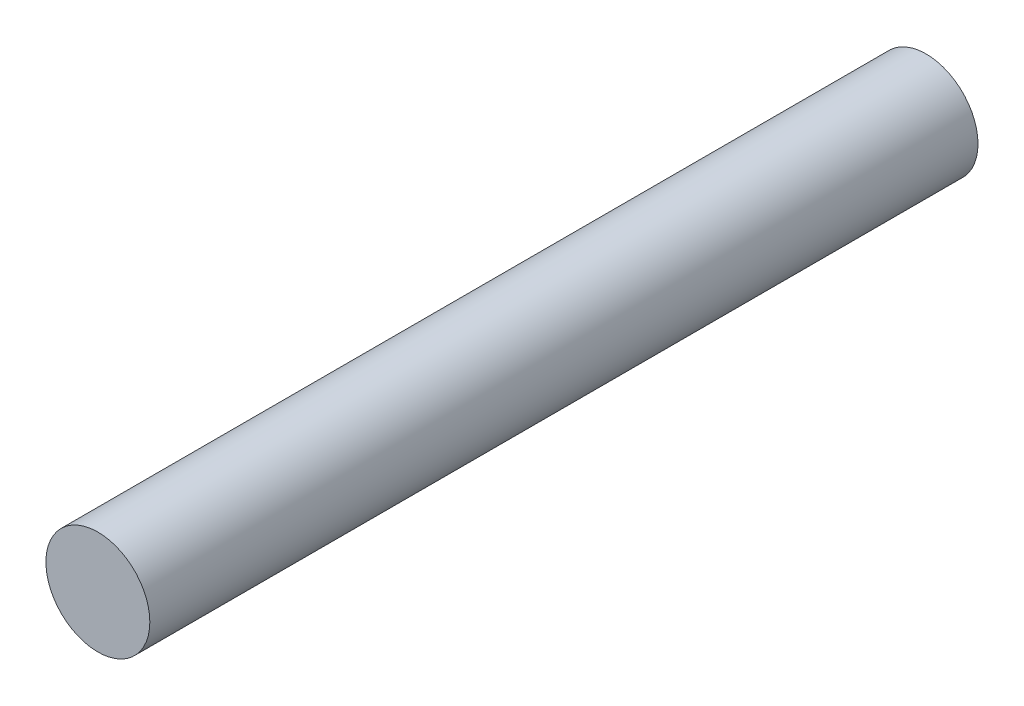
from build123d import *

# Parameters (mm, degrees)
ESQUISSE2_R        = 49.403
BOSS_EXTRU_1_DEPTH = 787.4


with BuildPart() as part:
    # Esquisse2 → Boss.-Extru.1 (new body)
    with BuildSketch(Plane.XY):
        Circle(ESQUISSE2_R)
    extrude(amount=BOSS_EXTRU_1_DEPTH)


solid = part.part
